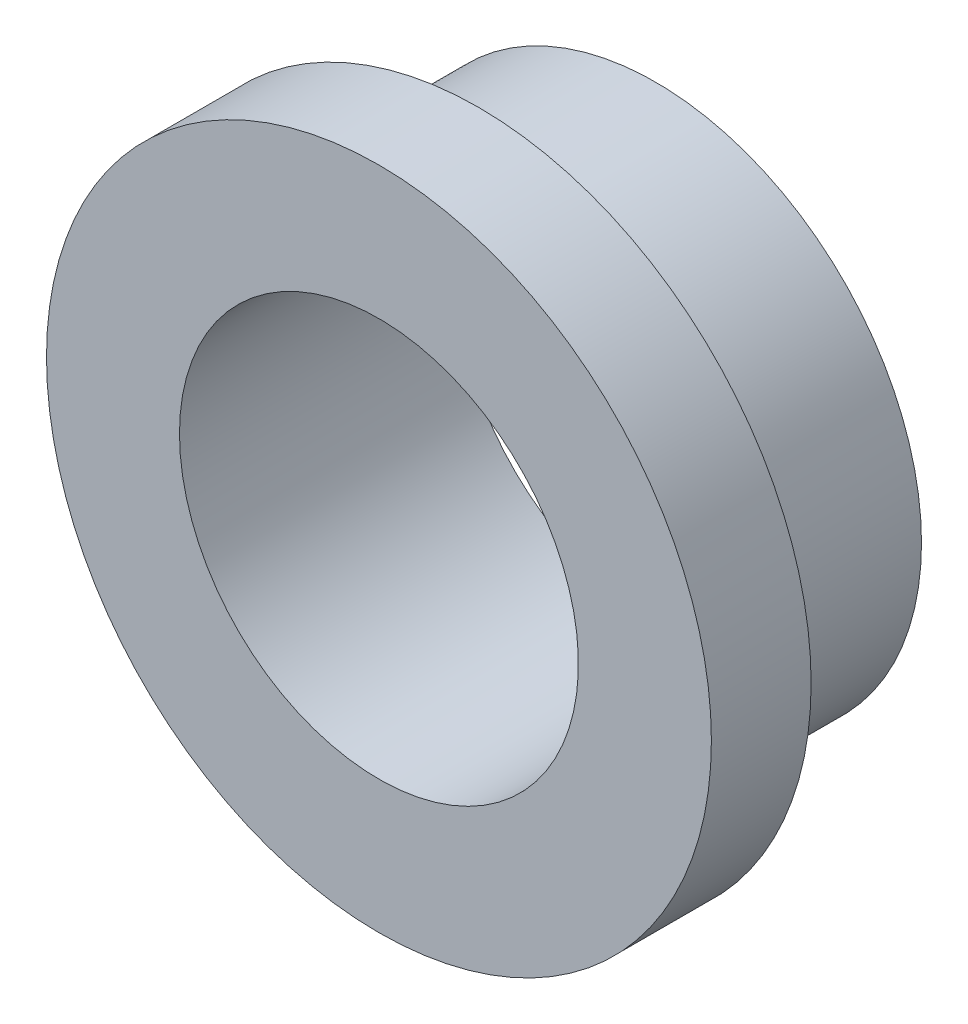
from build123d import *


with BuildPart() as part:
    # Sketch1 → Revolve1 (revolve)
    with BuildSketch(Plane(origin=(0, 0, 0), x_dir=(0, 0, -1), z_dir=(1, 0, 0)), mode=Mode.PRIVATE) as revolve1_sk:
        Polygon((0, 15.875), (4.7625, 15.875), (4.7625, 12.7), (13.208, 12.7), (13.208, 9.525), (0, 9.525), align=None)
    revolve(revolve1_sk.sketch.rotate(Axis((0, 0, 0), (0, 0, 1)), 90), axis=Axis((0, 0, 0), (0, 0, 1)))


solid = part.part
